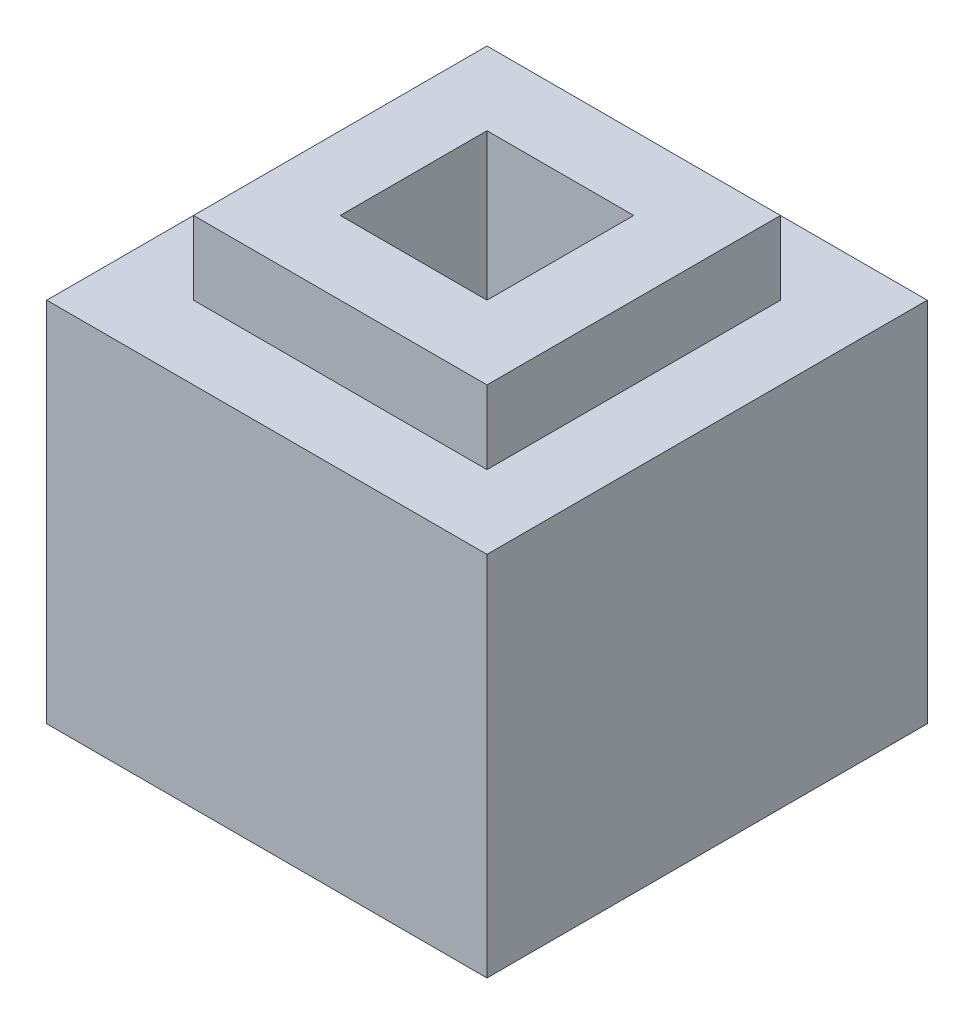
from build123d import *

# Parameters (mm, degrees)
SKETCH1_W           = 30
SKETCH1_H           = 30
BOSS_EXTRUDE1_DEPTH = 25
SKETCH3_W           = 10
SKETCH3_H           = 10
CUT_EXTRUDE1_DEPTH  = 20
SKETCH4_R           = 8
CUT_EXTRUDE2_DEPTH  = 15
SKETCH5_W           = 20
SKETCH5_H           = 20
BOSS_EXTRUDE2_DEPTH = 5
SKETCH6_W           = 10
SKETCH6_H           = 10
CUT_EXTRUDE3_DEPTH  = 15


with BuildPart() as part:
    # Sketch1 → Boss-Extrude1 (new body)
    with BuildSketch(Plane(origin=(0, 0, 0), x_dir=(1, 0, 0), z_dir=(0, 1, 0))):
        with Locations((15, 15)):
            Rectangle(SKETCH1_W, SKETCH1_H)
    extrude(amount=BOSS_EXTRUDE1_DEPTH)

    # Sketch3 → Cut-Extrude1 (cut)
    with BuildSketch(Plane(origin=(0, 25, 0), x_dir=(1, 0, 0), z_dir=(0, 1, 0))):
        with Locations((15, 15)):
            Rectangle(SKETCH3_W, SKETCH3_H)
    extrude(amount=-CUT_EXTRUDE1_DEPTH, mode=Mode.SUBTRACT)

    # Sketch4 → Cut-Extrude2 (cut)
    with BuildSketch(Plane.ZY):
        with Locations((-15, 10)):
            Circle(SKETCH4_R)
    extrude(amount=-CUT_EXTRUDE2_DEPTH, mode=Mode.SUBTRACT)

    # Sketch5 → Boss-Extrude2 (add)
    with BuildSketch(Plane(origin=(0, 25, 0), x_dir=(1, 0, 0), z_dir=(0, 1, 0))):
        with Locations((15, 15)):
            Rectangle(SKETCH5_W, SKETCH5_H)
    extrude(amount=BOSS_EXTRUDE2_DEPTH)

    # Sketch6 → Cut-Extrude3 (cut)
    with BuildSketch(Plane(origin=(0, 30, 0), x_dir=(1, 0, 0), z_dir=(0, 1, 0))):
        with Locations((15, 15)):
            Rectangle(SKETCH6_W, SKETCH6_H)
    extrude(amount=-CUT_EXTRUDE3_DEPTH, mode=Mode.SUBTRACT)


solid = part.part
